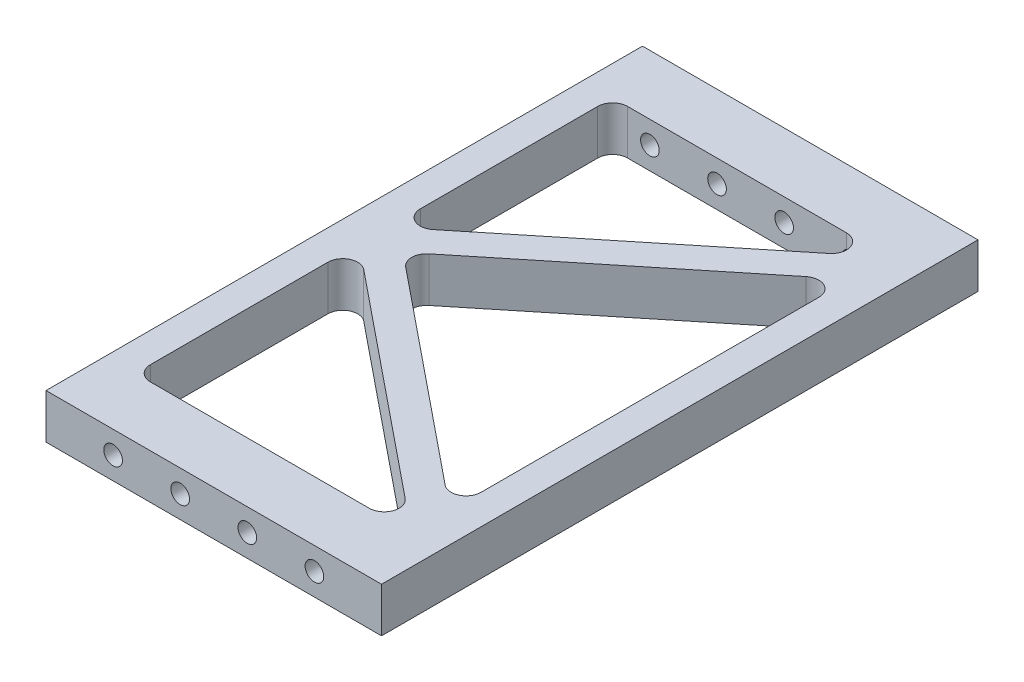
from build123d import *

# Parameters (mm, degrees)
SKETCH_1_W          = 45
SKETCH_1_H          = 80
EXTRUDE_1_DEPTH     = 6
CUT_EXTRUDE_2_DEPTH = 84.320165626
FILLET_10_R         = 2
M3X0_52_D           = 2.5
M3X0_52_DEPTH       = 8.5
M3X0_52_TIP         = 0.751075774
M3X0_51_D           = 2.5
M3X0_51_DEPTH       = 8.5
M3X0_51_TIP         = 0.751075774


with BuildPart() as part:
    # Эскиз1 → Бобышка-Вытянуть1 (new body)
    with BuildSketch(Plane(origin=(0, 0, 0), x_dir=(1, 0, 0), z_dir=(0, 1, 0))):
        with Locations((0, -40)):
            Rectangle(SKETCH_1_W, SKETCH_1_H)
    extrude(amount=EXTRUDE_1_DEPTH)

    # Эскиз13 → Вырез-Вытянуть2 (cut, through all)
    with BuildSketch(Plane(origin=(0, 6, 0), x_dir=(1, 0, 0), z_dir=(0, 1, 0))):
        Polygon((-18.5, -8), (18.5, -8), (-18.5, -38), align=None)
        Polygon((18.5, -72), (-18.5, -42), (-18.5, -72), align=None)
        Polygon((18.5, -13.149623941), (-14.615463806, -40), (18.5, -66.850376059), align=None)
    extrude(amount=-CUT_EXTRUDE_2_DEPTH, mode=Mode.SUBTRACT)

    # Скругление10
    fillet_10_edges = [part.edges().sort_by_distance(p)[0] for p in [
        (18.5, 3, 72),
        (-18.5, 3, 72),
        (-18.5, 3, 42),
        (-18.5, 3, 38),
        (-18.5, 3, 8),
        (18.5, 3, 8),
        (18.5, 3, 13.149623941),
        (18.5, 3, 66.850376059),
        (-14.615463806, 3, 40),
    ]]
    fillet(fillet_10_edges, radius=FILLET_10_R)

    # Отверстие обработанное метчиком M3x0.52
    with Locations(Plane(origin=(0, 0, 0), x_dir=(-1, 0, 0), z_dir=(0, 0, -1))):
        with Locations((-13.5, 3), (-4.5, 3), (4.5, 3), (13.5, 3)):
            Hole(M3X0_52_D / 2, depth=M3X0_52_DEPTH)
            with Locations((0, 0, -(M3X0_52_DEPTH + M3X0_52_TIP / 2))):  # 118° drill point
                Cone(0, M3X0_52_D / 2, M3X0_52_TIP, mode=Mode.SUBTRACT)

    # Отверстие обработанное метчиком M3x0.51
    with Locations(Plane.XY.offset(80)):
        with Locations((-13.5, 3), (-4.5, 3), (4.5, 3), (13.5, 3)):
            Hole(M3X0_51_D / 2, depth=M3X0_51_DEPTH)
            with Locations((0, 0, -(M3X0_51_DEPTH + M3X0_51_TIP / 2))):  # 118° drill point
                Cone(0, M3X0_51_D / 2, M3X0_51_TIP, mode=Mode.SUBTRACT)


solid = part.part
